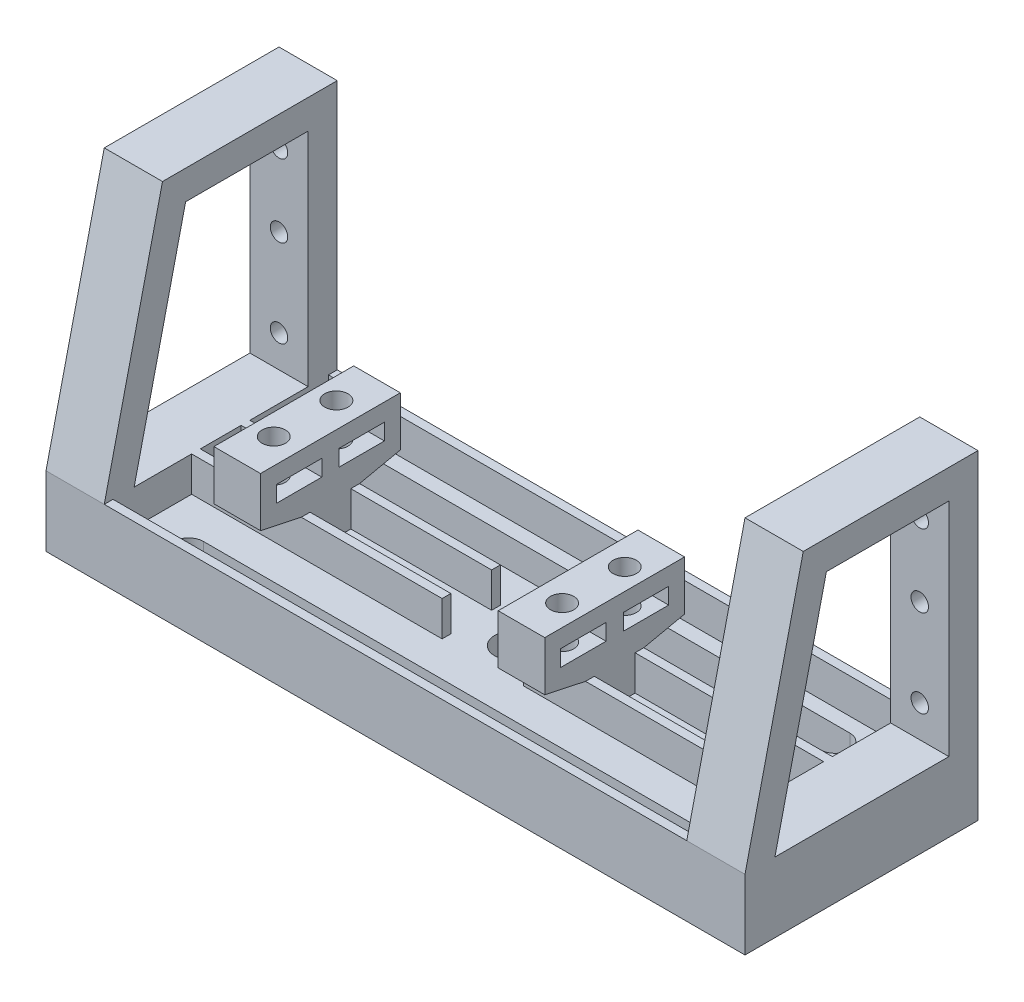
from build123d import *

# Parameters (mm, degrees)
BOSS_EXTRUDE1_DEPTH  = 100
BOSS_EXTRUDE2_DEPTH  = 8
BOSS_EXTRUDE3_DEPTH  = 8
SKETCH10_R           = 2
CUT_EXTRUDE4_DEPTH   = 8.75
SKETCH11_W           = 7.8
SKETCH11_H           = 2.8
CUT_EXTRUDE5_DEPTH   = 101.180739791
CUT_EXTRUDE1_REACH   = 111.927
SKETCH5_R            = 3
SKETCH6_W            = 14
SKETCH6_H            = 10
CUT_EXTRUDE2_DEPTH   = 6
BOSS_EXTRUDE4_DEPTH  = 10
BOSS_EXTRUDE11_DEPTH = 10
CUT_EXTRUDE3_REACH   = 131.325
SKETCH9_R            = 1.5


with BuildPart() as part:
    # Sketch1 → Boss-Extrude1 (new body)
    with BuildSketch(Plane(origin=(0, 0, 0), x_dir=(0, 0, -1), z_dir=(1, 0, 0))):
        Polygon((0, 0), (40, 0), (40, 12), (38.5, 12), (38.5, 6), (25, 6), (25, 12), (23.5, 12), (23.5, 6), (16.5, 6), (16.5, 12), (15, 12), (15, 6), (1.5, 6), (1.5, 12), (0, 12), align=None)
    extrude(amount=BOSS_EXTRUDE1_DEPTH)

    # Sketch2 → Boss-Extrude2 (add)
    with BuildSketch(Plane(origin=(18.825, 0, 0), x_dir=(0, 0, -1), z_dir=(1, 0, 0))):
        Polygon((15, 6), (15, 12), (8, 13.5), (8, 22), (32, 22), (32, 13.5), (25, 12), (25, 6), align=None)
    extrude(amount=-BOSS_EXTRUDE2_DEPTH)

    # Sketch4 → Boss-Extrude3 (add)
    with BuildSketch(Plane(origin=(59.625, 0, 0), x_dir=(0, 0, -1), z_dir=(1, 0, 0))):
        Polygon((25, 6), (15, 6), (15, 12), (8, 13.5), (8, 22), (32, 22), (32, 13.5), (25, 12), align=None)
    extrude(amount=BOSS_EXTRUDE3_DEPTH)

    # Sketch10 → Cut-Extrude4 (cut)
    with BuildSketch(Plane(origin=(0, 22, 0), x_dir=(1, 0, 0), z_dir=(0, 1, 0))):
        with Locations(Location((14.475, 14.625, 0), (0, 0, 270))):
            Circle(SKETCH10_R)
        with Locations(Location((14.475, 25.375, 0), (0, 0, 270))):
            Circle(SKETCH10_R)
        with Locations(Location((63.975, 14.625, 0), (0, 0, 270))):
            Circle(SKETCH10_R)
        with Locations(Location((63.975, 25.375, 0), (0, 0, 270))):
            Circle(SKETCH10_R)
    extrude(amount=-CUT_EXTRUDE4_DEPTH, mode=Mode.SUBTRACT)

    # Sketch11 → Cut-Extrude5 (cut, through all)
    with BuildSketch(Plane.ZY.offset(-10.825)):
        with Locations((-25.375, 17.6)):
            Rectangle(SKETCH11_W, SKETCH11_H)
        with Locations((-14.625, 17.6)):
            Rectangle(SKETCH11_W, SKETCH11_H)
    extrude(amount=-CUT_EXTRUDE5_DEPTH, mode=Mode.SUBTRACT)

    # Sketch5 → Cut-Extrude1 (cut, up to next)
    with BuildSketch(Plane.XZ, mode=Mode.PRIVATE) as cut_extrude1_sk1:
        with Locations(Location((50, -20, 0), (0, 0, 270))):
            Circle(SKETCH5_R)
    cut_extrude1_tool1 = extrude(cut_extrude1_sk1.sketch, amount=-CUT_EXTRUDE1_REACH, mode=Mode.PRIVATE) & part.part
    # Sketch5 → Cut-Extrude1 (cut, up to next)
    with BuildSketch(Plane.XZ, mode=Mode.PRIVATE) as cut_extrude1_sk2:
        with BuildLine():
            Line((8, -31), (92, -31))
            ThreePointArc((92, -31), (94.5, -33.5), (92, -36))
            Line((92, -36), (8, -36))
            ThreePointArc((8, -36), (5.5, -33.5), (8, -31))
        make_face()
    cut_extrude1_tool2 = extrude(cut_extrude1_sk2.sketch, amount=-CUT_EXTRUDE1_REACH, mode=Mode.PRIVATE) & part.part
    # Sketch5 → Cut-Extrude1 (cut, up to next)
    with BuildSketch(Plane.XZ, mode=Mode.PRIVATE) as cut_extrude1_sk3:
        with BuildLine():
            Line((92, -4), (8, -4))
            ThreePointArc((8, -4), (5.5, -6.5), (8, -9))
            Line((8, -9), (92, -9))
            ThreePointArc((92, -9), (94.5, -6.5), (92, -4))
        make_face()
    cut_extrude1_tool3 = extrude(cut_extrude1_sk3.sketch, amount=-CUT_EXTRUDE1_REACH, mode=Mode.PRIVATE) & part.part
    add(cut_extrude1_tool1.solids().sort_by_distance((50, 0, -20))[0], mode=Mode.SUBTRACT)
    add(cut_extrude1_tool2.solids().sort_by_distance((50, 0, -33.5))[0], mode=Mode.SUBTRACT)
    add(cut_extrude1_tool3.solids().sort_by_distance((50, 0, -6.5))[0], mode=Mode.SUBTRACT)

    # Sketch6 → Cut-Extrude2 (cut)
    with BuildSketch(Plane(origin=(0, 6, 0), x_dir=(1, 0, 0), z_dir=(0, 1, 0))):
        with Locations((50, 20)):
            Rectangle(SKETCH6_W, SKETCH6_H)
    extrude(amount=CUT_EXTRUDE2_DEPTH, mode=Mode.SUBTRACT)

    # Sketch7 → Boss-Extrude4 (add)
    with BuildSketch(Plane(origin=(100, 0, 0), x_dir=(0, 0, -1), z_dir=(1, 0, 0))):
        Polygon((0, 0), (40, 0), (40, 12), (40, 55), (10, 55), (0, 12), align=None)
        Polygon((35, 50), (13.970637222, 50), (5.13342792, 12), (35, 12), align=None, mode=Mode.SUBTRACT)
    extrude(amount=BOSS_EXTRUDE4_DEPTH)

    # Sketch8 → Boss-Extrude11 (add)
    with BuildSketch(Plane.ZY):
        Polygon((-40, 0), (-40, 55), (-10, 55), (0, 12), (0, 0), align=None)
        Polygon((-35, 50), (-13.970637222, 50), (-5.13342792, 12), (-35, 12), align=None, mode=Mode.SUBTRACT)
    extrude(amount=BOSS_EXTRUDE11_DEPTH)

    # Sketch9 → Cut-Extrude3 (cut, up to next)
    with BuildSketch(Plane(origin=(0, 0, -40), x_dir=(-1, 0, 0), z_dir=(0, 0, -1)), mode=Mode.PRIVATE) as cut_extrude3_sk1:
        with Locations((-105, 45)):
            Circle(SKETCH9_R)
    cut_extrude3_tool1 = extrude(cut_extrude3_sk1.sketch, amount=-CUT_EXTRUDE3_REACH, mode=Mode.PRIVATE) & part.part
    # Sketch9 → Cut-Extrude3 (cut, up to next)
    with BuildSketch(Plane(origin=(0, 0, -40), x_dir=(-1, 0, 0), z_dir=(0, 0, -1)), mode=Mode.PRIVATE) as cut_extrude3_sk2:
        with Locations((-105, 32.5)):
            Circle(SKETCH9_R)
    cut_extrude3_tool2 = extrude(cut_extrude3_sk2.sketch, amount=-CUT_EXTRUDE3_REACH, mode=Mode.PRIVATE) & part.part
    # Sketch9 → Cut-Extrude3 (cut, up to next)
    with BuildSketch(Plane(origin=(0, 0, -40), x_dir=(-1, 0, 0), z_dir=(0, 0, -1)), mode=Mode.PRIVATE) as cut_extrude3_sk3:
        with Locations((-105, 17.5)):
            Circle(SKETCH9_R)
    cut_extrude3_tool3 = extrude(cut_extrude3_sk3.sketch, amount=-CUT_EXTRUDE3_REACH, mode=Mode.PRIVATE) & part.part
    # Sketch9 → Cut-Extrude3 (cut, up to next)
    with BuildSketch(Plane(origin=(0, 0, -40), x_dir=(-1, 0, 0), z_dir=(0, 0, -1)), mode=Mode.PRIVATE) as cut_extrude3_sk4:
        with Locations((5, 45)):
            Circle(SKETCH9_R)
    cut_extrude3_tool4 = extrude(cut_extrude3_sk4.sketch, amount=-CUT_EXTRUDE3_REACH, mode=Mode.PRIVATE) & part.part
    # Sketch9 → Cut-Extrude3 (cut, up to next)
    with BuildSketch(Plane(origin=(0, 0, -40), x_dir=(-1, 0, 0), z_dir=(0, 0, -1)), mode=Mode.PRIVATE) as cut_extrude3_sk5:
        with Locations((5, 32.5)):
            Circle(SKETCH9_R)
    cut_extrude3_tool5 = extrude(cut_extrude3_sk5.sketch, amount=-CUT_EXTRUDE3_REACH, mode=Mode.PRIVATE) & part.part
    # Sketch9 → Cut-Extrude3 (cut, up to next)
    with BuildSketch(Plane(origin=(0, 0, -40), x_dir=(-1, 0, 0), z_dir=(0, 0, -1)), mode=Mode.PRIVATE) as cut_extrude3_sk6:
        with Locations((5, 17.5)):
            Circle(SKETCH9_R)
    cut_extrude3_tool6 = extrude(cut_extrude3_sk6.sketch, amount=-CUT_EXTRUDE3_REACH, mode=Mode.PRIVATE) & part.part
    add(cut_extrude3_tool1.solids().sort_by_distance((105, 45, -40))[0], mode=Mode.SUBTRACT)
    add(cut_extrude3_tool2.solids().sort_by_distance((105, 32.5, -40))[0], mode=Mode.SUBTRACT)
    add(cut_extrude3_tool3.solids().sort_by_distance((105, 17.5, -40))[0], mode=Mode.SUBTRACT)
    add(cut_extrude3_tool4.solids().sort_by_distance((-5, 45, -40))[0], mode=Mode.SUBTRACT)
    add(cut_extrude3_tool5.solids().sort_by_distance((-5, 32.5, -40))[0], mode=Mode.SUBTRACT)
    add(cut_extrude3_tool6.solids().sort_by_distance((-5, 17.5, -40))[0], mode=Mode.SUBTRACT)


solid = part.part
